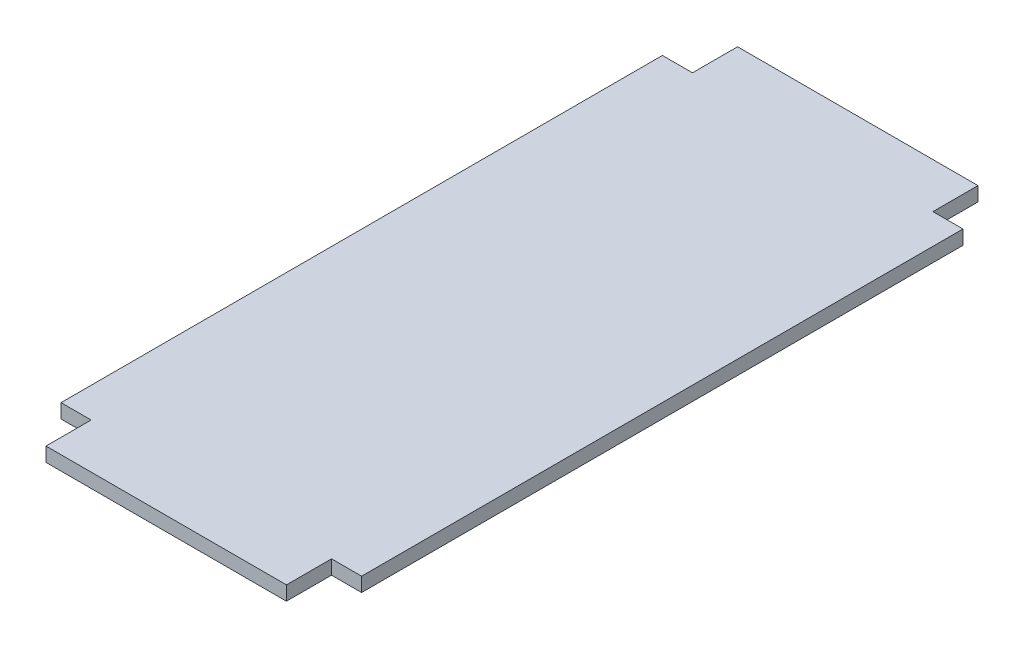
from build123d import *

# Parameters (mm, degrees)
BOSS_EXTRUDE1_DEPTH = 2.9972


with BuildPart() as part:
    # Sketch1 → Boss-Extrude1 (new body)
    with BuildSketch(Plane(origin=(0, 0, 0), x_dir=(1, 0, 0), z_dir=(0, 1, 0))):
        Polygon((-25.3873, -73.025), (25.3873, -73.025), (25.3873, -63.5), (31.7373, -63.5), (31.7373, 63.5), (25.3873, 63.5), (25.3873, 73.025), (-25.3873, 73.025), (-25.3873, 63.5), (-31.7373, 63.5), (-31.7373, -63.5), (-25.3873, -63.5), align=None)
    extrude(amount=BOSS_EXTRUDE1_DEPTH)


solid = part.part
